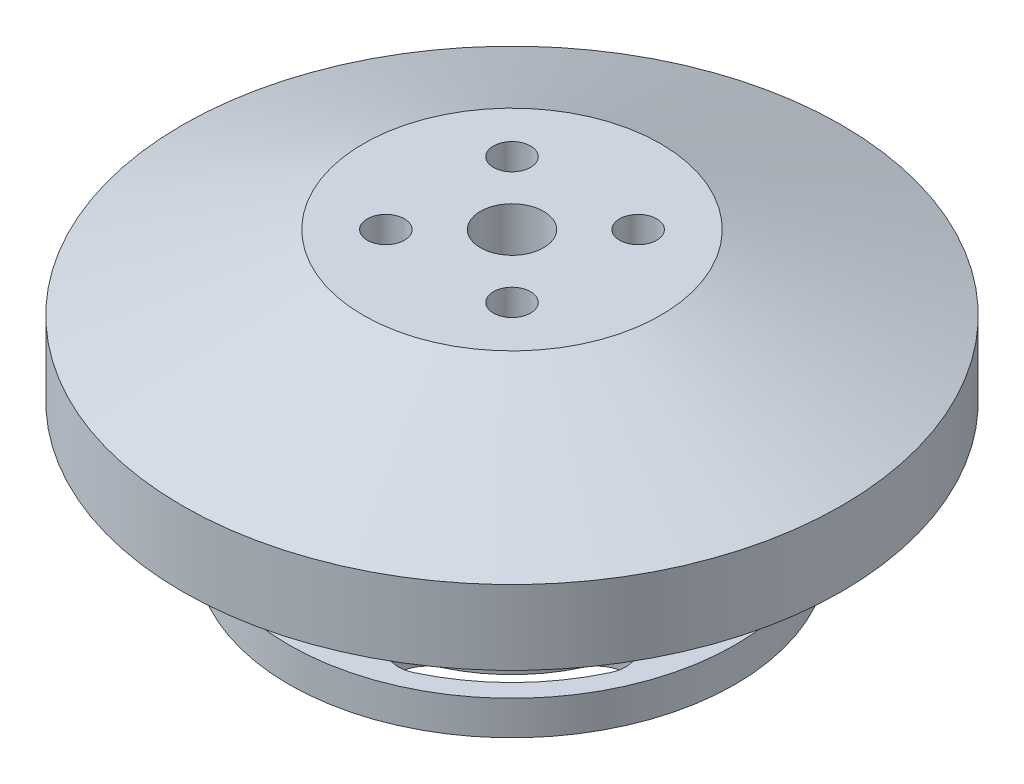
from build123d import *

# Parameters (mm, degrees)
ESQUISSE1_R                = 22.175
BOSS_EXTRU_1_DEPTH         = 5
TROU_TARAUD_M31_D          = 2.5
TROU_TARAUD_M31_DEPTH      = 5.5
TROU_TARAUD_M31_TIP        = 0.751075774
BOSS_EXTRU_2_DEPTH         = 6.7
BOSS_EXTRU_2_DEPTH_BACK    = 5.5
ESQUISSE9_R                = 8
ESQUISSE10_R               = 15
BOSS_EXTRU_3_DEPTH         = 2.3
TROU_TARAUD_M32_AT_2_COUNT = 2
TROU_TARAUD_M32_AT_2_PITCH = 17.67766953
TROU_TARAUD_M32_AT_3_COUNT = 2
TROU_TARAUD_M32_AT_3_PITCH = 17.67766953
TROU_TARAUD_M32_AT_4_COUNT = 2
TROU_TARAUD_M32_AT_4_PITCH = 25
ENL_V_MAT_EXTRU_2_DEPTH    = 2.3
ESQUISSE14_R               = 2.125
ENL_V_MAT_EXTRU_3_DEPTH    = 37.666895833
ESQUISSE15_R               = 21
ENL_V_MAT_EXTRU_4_DEPTH    = 2.3
ESQUISSE16_OUTSIDE_W       = 59.458
ESQUISSE16_OUTSIDE_H       = 59.458
ESQUISSE16_OUTSIDE_R       = 7.5
ENL_V_MAT_EXTRU_5_DEPTH    = 6.3


with BuildPart() as part:
    # Esquisse1 → Boss.-Extru.1 (new body)
    with BuildSketch(Plane(origin=(0, 0, 0), x_dir=(1, 0, 0), z_dir=(0, 1, 0))):
        with Locations(Location((0, 0, 0), (0, 0, 270))):
            Circle(ESQUISSE1_R)
    extrude(amount=BOSS_EXTRU_1_DEPTH)

    # Esquisse2 → Révolution1 (revolve)
    with BuildSketch(Plane.XY, mode=Mode.PRIVATE) as r_volution1_sk:
        Polygon((0, 10), (-10, 10), (-22.175, 5), (0, 5), align=None)
    revolve(r_volution1_sk.sketch.rotate(Axis((0, 17.696721124, 0), (0, -1, 0)), 270), axis=Axis((0, 17.696721124, 0), (0, -1, 0)))

    # Trou taraudé M31
    with Locations(Plane(origin=(4.242640687, 10, -4.242640687), x_dir=(0, 0, 1), z_dir=(0, 1, 0))):
        with Locations((0, 0), (8.485281374, 0), (8.485281374, -8.485281374), (0, -8.485281374)):
            Hole(TROU_TARAUD_M31_D / 2, depth=TROU_TARAUD_M31_DEPTH)
            with Locations((0, 0, -(TROU_TARAUD_M31_DEPTH + TROU_TARAUD_M31_TIP / 2))):  # 118° drill point
                Cone(0, TROU_TARAUD_M31_D / 2, TROU_TARAUD_M31_TIP, mode=Mode.SUBTRACT)


with BuildPart() as body_2:
    # Esquisse9 → Boss.-Extru.2 (new, two sides: drawn at the far end of the back side and taken through both)
    with BuildSketch(Plane.XZ.offset(-BOSS_EXTRU_2_DEPTH_BACK)):
        with Locations(Location((0, 0, 0), (0, 0, 270))):
            Circle(ESQUISSE9_R)
    extrude(amount=BOSS_EXTRU_2_DEPTH + BOSS_EXTRU_2_DEPTH_BACK)

    # Esquisse10 → Boss.-Extru.3 (add)
    with BuildSketch(Plane.XZ.offset(6.7)):
        with Locations(Location((0, 0, 0), (0, 0, 270))):
            Circle(ESQUISSE10_R)
    extrude(amount=BOSS_EXTRU_3_DEPTH)

    # Esquisse12 → Trou taraudé M32 (revolve, cut)
    with BuildSketch(Plane(origin=(0, -9, 12.5), x_dir=(0, 0, -1), z_dir=(1, 0, 0))):
        Polygon((0, 0), (0, 6.251075774), (1.25, 5.5), (1.25, 0), align=None)
    trou_taraud_m32 = revolve(axis=Axis((0, -15.35, 12.5), (0, 1, 0)), mode=Mode.SUBTRACT)

    # Trou taraudé M32 at 2: Trou taraudé M32 ×2
    with Locations(*[Vector(0.7071067811865676, 0, -0.7071067811865276) * (i * TROU_TARAUD_M32_AT_2_PITCH) for i in range(1, TROU_TARAUD_M32_AT_2_COUNT)]):
        add(trou_taraud_m32, mode=Mode.SUBTRACT)

    # Trou taraudé M32 at 3: Trou taraudé M32 ×2
    with Locations(*[Vector(-0.7071067811865276, 0, -0.7071067811865676) * (i * TROU_TARAUD_M32_AT_3_PITCH) for i in range(1, TROU_TARAUD_M32_AT_3_COUNT)]):
        add(trou_taraud_m32, mode=Mode.SUBTRACT)

    # Trou taraudé M32 at 4: Trou taraudé M32 ×2
    with Locations(*[(0, 0, -i * TROU_TARAUD_M32_AT_4_PITCH) for i in range(1, TROU_TARAUD_M32_AT_4_COUNT)]):
        add(trou_taraud_m32, mode=Mode.SUBTRACT)

    # Esquisse13 → Enlèv. mat.-Extru.2 (cut)
    with BuildSketch(Plane.XZ.offset(9)):
        with BuildLine():
            ThreePointArc((-5.789870186, 12.416416682), (-9.687362902, 9.687362902), (-12.416416682, 5.789870186))
            ThreePointArc((-12.416416682, 5.789870186), (-11.473222108, 3.198464391), (-8.881816313, 4.141658965))
            ThreePointArc((-8.881816313, 4.141658965), (-6.929646456, 6.929646456), (-4.141658965, 8.881816313))
            ThreePointArc((-4.141658965, 8.881816313), (-3.198464391, 11.473222108), (-5.789870186, 12.416416682))
        make_face()
        with BuildLine():
            ThreePointArc((12.416416682, 5.789870186), (9.687362902, 9.687362902), (5.789870186, 12.416416682))
            ThreePointArc((5.789870186, 12.416416682), (3.198464391, 11.473222108), (4.141658965, 8.881816313))
            ThreePointArc((4.141658965, 8.881816313), (6.929646456, 6.929646456), (8.881816313, 4.141658965))
            ThreePointArc((8.881816313, 4.141658965), (11.473222108, 3.198464391), (12.416416682, 5.789870186))
        make_face()
        with BuildLine():
            ThreePointArc((5.789870186, -12.416416682), (9.687362902, -9.687362902), (12.416416682, -5.789870186))
            ThreePointArc((12.416416682, -5.789870186), (11.473222108, -3.198464391), (8.881816313, -4.141658965))
            ThreePointArc((8.881816313, -4.141658965), (6.929646456, -6.929646456), (4.141658965, -8.881816313))
            ThreePointArc((4.141658965, -8.881816313), (3.198464391, -11.473222108), (5.789870186, -12.416416682))
        make_face()
        with BuildLine():
            ThreePointArc((-12.416416682, -5.789870186), (-9.687362902, -9.687362902), (-5.789870186, -12.416416682))
            ThreePointArc((-5.789870186, -12.416416682), (-3.198464391, -11.473222108), (-4.141658965, -8.881816313))
            ThreePointArc((-4.141658965, -8.881816313), (-6.929646456, -6.929646456), (-8.881816313, -4.141658965))
            ThreePointArc((-8.881816313, -4.141658965), (-11.473222108, -3.198464391), (-12.416416682, -5.789870186))
        make_face()
    extrude(amount=-ENL_V_MAT_EXTRU_2_DEPTH, mode=Mode.SUBTRACT)


with BuildPart() as enl_v_mat_extru_3_tool:
    # Esquisse14 → Enlèv. mat.-Extru.3 (new, through all)
    with BuildSketch(Plane(origin=(0, 10, 0), x_dir=(1, 0, 0), z_dir=(0, 1, 0))):
        with Locations(Location((0, 0, 0), (0, 0, 270))):
            Circle(ESQUISSE14_R)
    extrude(amount=-ENL_V_MAT_EXTRU_3_DEPTH)


with BuildPart() as part_1:
    add(part.part)

    # Enlèv. mat.-Extru.3: cut by enl_v_mat_extru_3_tool
    add(enl_v_mat_extru_3_tool.part, mode=Mode.SUBTRACT)

    # Esquisse15 → Enlèv. mat.-Extru.4 (cut)
    with BuildSketch(Plane.XZ):
        with Locations(Location((0, 0, 0), (0, 0, 270))):
            Circle(ESQUISSE15_R)
    extrude(amount=-ENL_V_MAT_EXTRU_4_DEPTH, mode=Mode.SUBTRACT)


with BuildPart() as body_2_1:
    add(body_2.part)

    # Enlèv. mat.-Extru.3: cut by enl_v_mat_extru_3_tool
    add(enl_v_mat_extru_3_tool.part, mode=Mode.SUBTRACT)

    # Esquisse16 outside → Enlèv. mat.-Extru.5 (cut)
    with BuildSketch(Plane(origin=(0, 5.5, 0), x_dir=(1, 0, 0), z_dir=(0, 1, 0))):
        Rectangle(ESQUISSE16_OUTSIDE_W, ESQUISSE16_OUTSIDE_H)
        with Locations(Location((0, 0, 0), (0, 0, 270))):
            Circle(ESQUISSE16_OUTSIDE_R, mode=Mode.SUBTRACT)
    extrude(amount=-ENL_V_MAT_EXTRU_5_DEPTH, mode=Mode.SUBTRACT)


solid = Compound([part_1.part, body_2_1.part])
